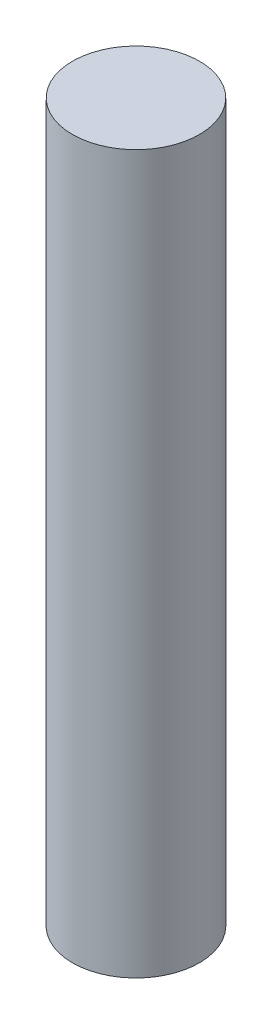
from build123d import *

# Parameters (mm, degrees)
CROQUIS1_R              = 2.475
SALIENTE_EXTRUIR1_DEPTH = 27.96


with BuildPart() as part:
    # Croquis1 → Saliente-Extruir1 (new body)
    with BuildSketch(Plane(origin=(0, 0, 0), x_dir=(1, 0, 0), z_dir=(0, 1, 0))):
        with Locations(Location((0, 0, 0), (0, 0, 270))):
            Circle(CROQUIS1_R)
    extrude(amount=SALIENTE_EXTRUIR1_DEPTH)


solid = part.part
